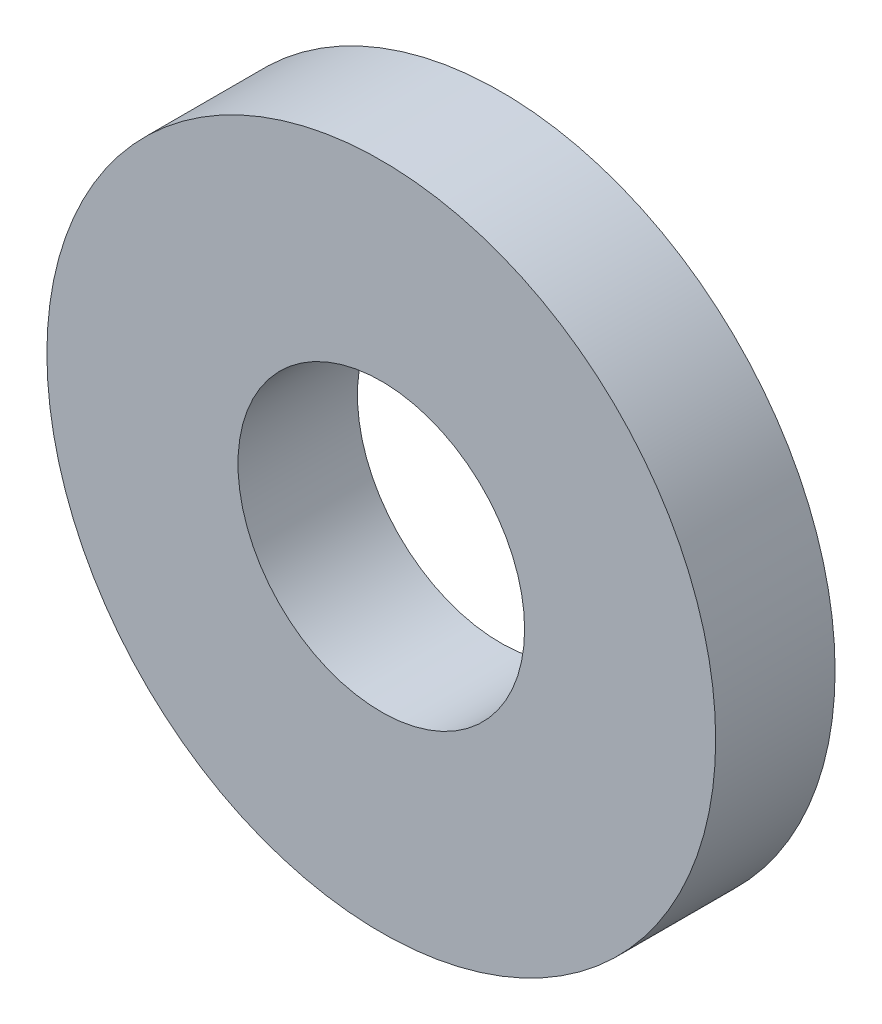
from build123d import *

# Parameters (mm, degrees)
SKETCH1_R           = 8.89
SKETCH1_R_2         = 3.81
BOSS_EXTRUDE1_DEPTH = 3.175


with BuildPart() as part:
    # Sketch1 → Boss-Extrude1 (new body)
    with BuildSketch(Plane.XY):
        Circle(SKETCH1_R)
        Circle(SKETCH1_R_2, mode=Mode.SUBTRACT)
    extrude(amount=BOSS_EXTRUDE1_DEPTH)


solid = part.part
